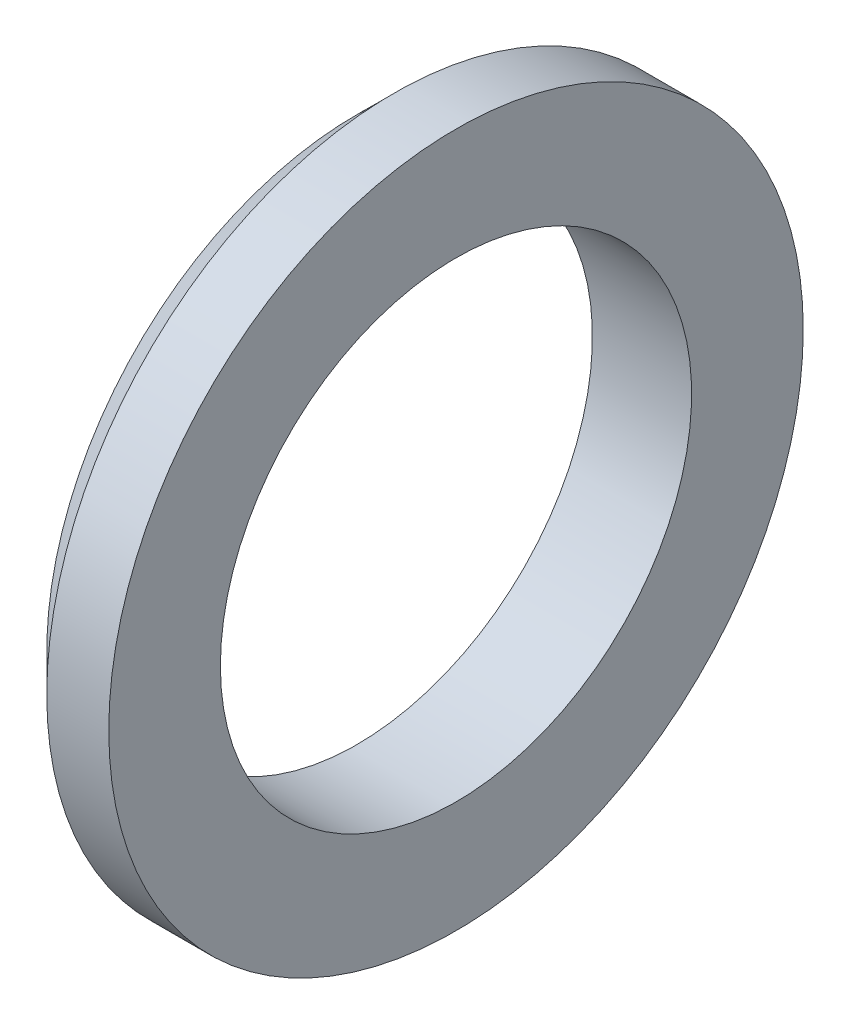
from build123d import *

# Parameters (mm, degrees)
SKETCH_1_W     = 4
SKETCH_1_H     = 4.5
CHAMFER_1_SIZE = 1.5


with BuildPart() as part:
    # 草图1 → 旋转1 (revolve)
    with BuildSketch(Plane.XY, mode=Mode.PRIVATE) as revolve_1_sk:
        with Locations((-2, 11.75)):
            Rectangle(SKETCH_1_W, SKETCH_1_H)
    revolve(revolve_1_sk.sketch.rotate(Axis((-16.983302851, 0, 0), (1, 0, 0)), 90), axis=Axis((-16.983302851, 0, 0), (1, 0, 0)))

    # 倒角1
    chamfer_1_edges = [part.edges().sort_by_distance(p)[0] for p in [
        (-4, 0, -14),
    ]]
    chamfer(chamfer_1_edges, length=CHAMFER_1_SIZE)


solid = part.part
